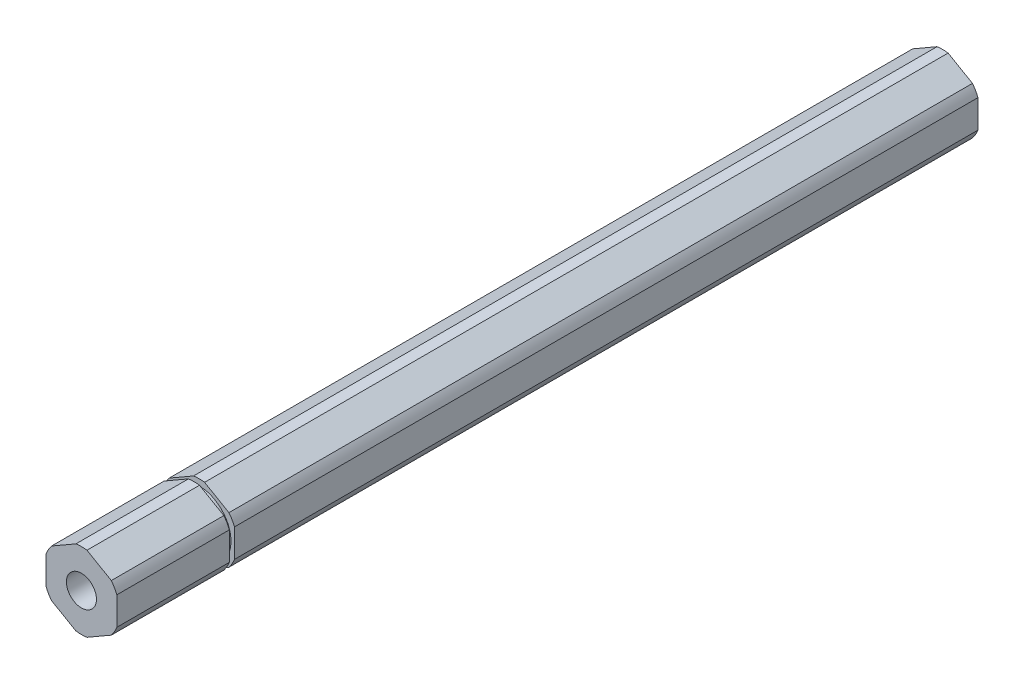
from build123d import *

# Parameters (mm, degrees)
BOSS_EXTRUDE1_DEPTH = 57.88025
SKETCH2_R           = 2.0193
CUT_EXTRUDE1_DEPTH  = 19.05
SKETCH4_R           = 6.35
SKETCH4_R_2         = 4.2926
CUT_EXTRUDE2_DEPTH  = 0.6858


with BuildPart() as part:
    # Sketch1 → Boss-Extrude1 (new, symmetric)
    with BuildSketch(Plane.XY):
        with BuildLine():
            ThreePointArc((4.7625, 1.891713919), (4.43790388, 2.562225), (4.019522311, 3.178589026))
            Line((4.019522311, 3.178589026), (0.742977689, 5.070302945))
            ThreePointArc((0.742977689, 5.070302945), (0, 5.12445), (-0.742977689, 5.070302945))
            Line((-0.742977689, 5.070302945), (-4.019522311, 3.178589026))
            ThreePointArc((-4.019522311, 3.178589026), (-4.43790388, 2.562225), (-4.7625, 1.891713919))
            Line((-4.7625, 1.891713919), (-4.7625, -1.891713919))
            ThreePointArc((-4.7625, -1.891713919), (-4.43790388, -2.562225), (-4.019522311, -3.178589026))
            Line((-4.019522311, -3.178589026), (-0.742977689, -5.070302945))
            ThreePointArc((-0.742977689, -5.070302945), (0, -5.12445), (0.742977689, -5.070302945))
            Line((0.742977689, -5.070302945), (4.019522311, -3.178589026))
            ThreePointArc((4.019522311, -3.178589026), (4.43790388, -2.562225), (4.7625, -1.891713919))
            Line((4.7625, -1.891713919), (4.7625, 1.891713919))
        make_face()
    extrude(amount=BOSS_EXTRUDE1_DEPTH, both=True)

    # Sketch2 → Cut-Extrude1 (cut)
    with BuildSketch(Plane(origin=(0, 0, -57.88025), x_dir=(-1, 0, 0), z_dir=(0, 0, -1))):
        Circle(SKETCH2_R)
    cut_extrude1 = extrude(amount=-CUT_EXTRUDE1_DEPTH, mode=Mode.SUBTRACT)

    # Mirror1: Cut-Extrude1 across plane
    add(cut_extrude1.mirror(Plane.XY), mode=Mode.SUBTRACT)

    # Sketch4 → Cut-Extrude2 (cut)
    with BuildSketch(Plane(origin=(0, 0, 42.06875), x_dir=(-1, 0, 0), z_dir=(0, 0, -1))):
        Circle(SKETCH4_R)
        Circle(SKETCH4_R_2, mode=Mode.SUBTRACT)
    extrude(amount=-CUT_EXTRUDE2_DEPTH, mode=Mode.SUBTRACT)


solid = part.part
